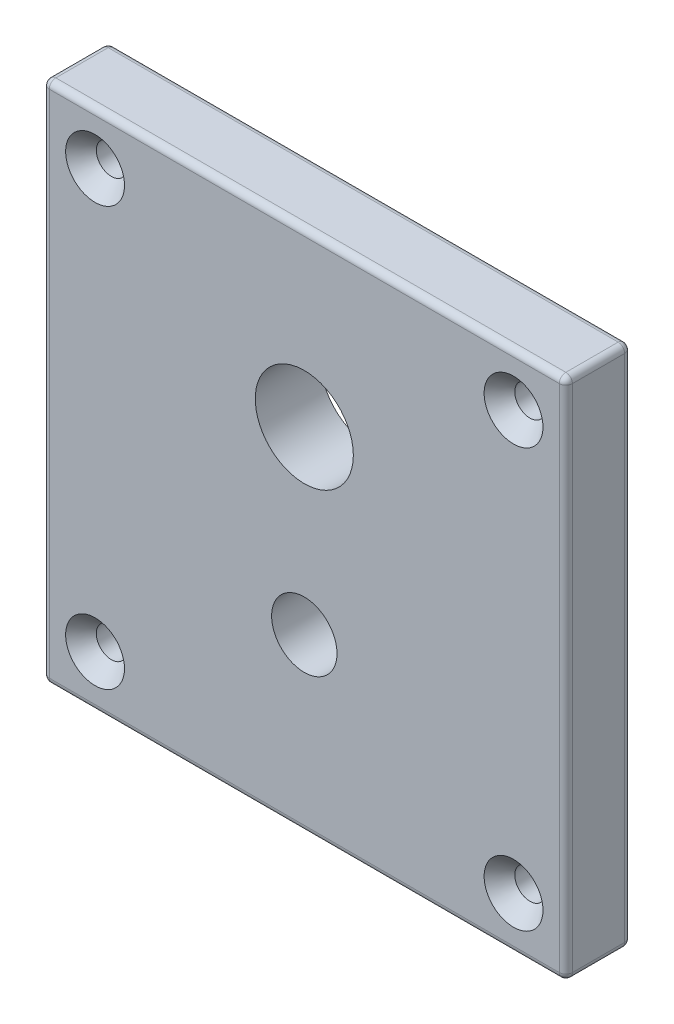
from build123d import *

# Parameters (mm, degrees)
SKETCH1_W                                      = 50.8
SKETCH1_H                                      = 50.8
BOSS_EXTRUDE1_DEPTH                            = 6.35
CUT_EXTRUDE1_REACH                             = 38.478
SKETCH2_R                                      = 4.7625
SKETCH2_R_2                                    = 3.175
CUT_EXTRUDE2_REACH                             = 38.478
SKETCH5_R                                      = 1.4732
CSK_FOR_4_FLAT_HEAD_MACHINE_SCREW1_D           = 2.9464
CSK_FOR_4_FLAT_HEAD_MACHINE_SCREW1_CSINK_D     = 5.715
CSK_FOR_4_FLAT_HEAD_MACHINE_SCREW1_CSINK_ANGLE = 82
FILLET1_R                                      = 0.635


with BuildPart() as part:
    # Sketch1 → Boss-Extrude1 (new body)
    with BuildSketch(Plane(origin=(0, 0, 0), x_dir=(0, 1, 0), z_dir=(0, 0, 1))):
        Rectangle(SKETCH1_W, SKETCH1_H)
    extrude(amount=BOSS_EXTRUDE1_DEPTH)

    # Sketch2 → Cut-Extrude1 (cut, up to next)
    with BuildSketch(Plane.XY.offset(6.35), mode=Mode.PRIVATE) as cut_extrude1_sk1:
        with Locations((0, 8.73125)):
            Circle(SKETCH2_R)
    cut_extrude1_tool1 = extrude(cut_extrude1_sk1.sketch, amount=-CUT_EXTRUDE1_REACH, mode=Mode.PRIVATE) & part.part
    # Sketch2 → Cut-Extrude1 (cut, up to next)
    with BuildSketch(Plane.XY.offset(6.35), mode=Mode.PRIVATE) as cut_extrude1_sk2:
        with Locations((0, -8.73125)):
            Circle(SKETCH2_R_2)
    cut_extrude1_tool2 = extrude(cut_extrude1_sk2.sketch, amount=-CUT_EXTRUDE1_REACH, mode=Mode.PRIVATE) & part.part
    add(cut_extrude1_tool1.solids().sort_by_distance((0, 8.73125, 6.35))[0], mode=Mode.SUBTRACT)
    add(cut_extrude1_tool2.solids().sort_by_distance((0, -8.73125, 6.35))[0], mode=Mode.SUBTRACT)

    # Sketch5 → Cut-Extrude2 (cut, up to next)
    with BuildSketch(Plane.XY.offset(6.35), mode=Mode.PRIVATE) as cut_extrude2_sk1:
        with Locations((-20.32, 20.32)):
            Circle(SKETCH5_R)
    cut_extrude2_tool1 = extrude(cut_extrude2_sk1.sketch, amount=-CUT_EXTRUDE2_REACH, mode=Mode.PRIVATE) & part.part
    # Sketch5 → Cut-Extrude2 (cut, up to next)
    with BuildSketch(Plane.XY.offset(6.35), mode=Mode.PRIVATE) as cut_extrude2_sk2:
        with Locations((20.32, 20.32)):
            Circle(SKETCH5_R)
    cut_extrude2_tool2 = extrude(cut_extrude2_sk2.sketch, amount=-CUT_EXTRUDE2_REACH, mode=Mode.PRIVATE) & part.part
    # Sketch5 → Cut-Extrude2 (cut, up to next)
    with BuildSketch(Plane.XY.offset(6.35), mode=Mode.PRIVATE) as cut_extrude2_sk3:
        with Locations((-20.32, -20.32)):
            Circle(SKETCH5_R)
    cut_extrude2_tool3 = extrude(cut_extrude2_sk3.sketch, amount=-CUT_EXTRUDE2_REACH, mode=Mode.PRIVATE) & part.part
    # Sketch5 → Cut-Extrude2 (cut, up to next)
    with BuildSketch(Plane.XY.offset(6.35), mode=Mode.PRIVATE) as cut_extrude2_sk4:
        with Locations((20.32, -20.32)):
            Circle(SKETCH5_R)
    cut_extrude2_tool4 = extrude(cut_extrude2_sk4.sketch, amount=-CUT_EXTRUDE2_REACH, mode=Mode.PRIVATE) & part.part
    add(cut_extrude2_tool1.solids().sort_by_distance((-20.32, 20.32, 6.35))[0], mode=Mode.SUBTRACT)
    add(cut_extrude2_tool2.solids().sort_by_distance((20.32, 20.32, 6.35))[0], mode=Mode.SUBTRACT)
    add(cut_extrude2_tool3.solids().sort_by_distance((-20.32, -20.32, 6.35))[0], mode=Mode.SUBTRACT)
    add(cut_extrude2_tool4.solids().sort_by_distance((20.32, -20.32, 6.35))[0], mode=Mode.SUBTRACT)

    # CSK for #4 Flat Head Machine Screw1 (through all)
    with Locations(Plane.XY.offset(6.35)):
        with Locations((-20.32, 20.32), (20.32, 20.32), (20.32, -20.32), (-20.32, -20.32)):
            CounterSinkHole(CSK_FOR_4_FLAT_HEAD_MACHINE_SCREW1_D / 2, CSK_FOR_4_FLAT_HEAD_MACHINE_SCREW1_CSINK_D / 2, counter_sink_angle=CSK_FOR_4_FLAT_HEAD_MACHINE_SCREW1_CSINK_ANGLE)

    # Fillet1
    fillet1_edges = [part.edges().sort_by_distance(p)[0] for p in [
        (0, -25.4, 6.35),
        (25.4, 0, 6.35),
        (0, 25.4, 6.35),
        (25.4, 0, 0),
        (0, -25.4, 0),
        (-25.4, 0, 0),
        (0, 25.4, 0),
        (25.4, 25.4, 3.175),
        (25.4, -25.4, 3.175),
        (-25.4, -25.4, 3.175),
        (-25.4, 25.4, 3.175),
        (-25.4, 0, 6.35),
    ]]
    fillet(fillet1_edges, radius=FILLET1_R)


solid = part.part
